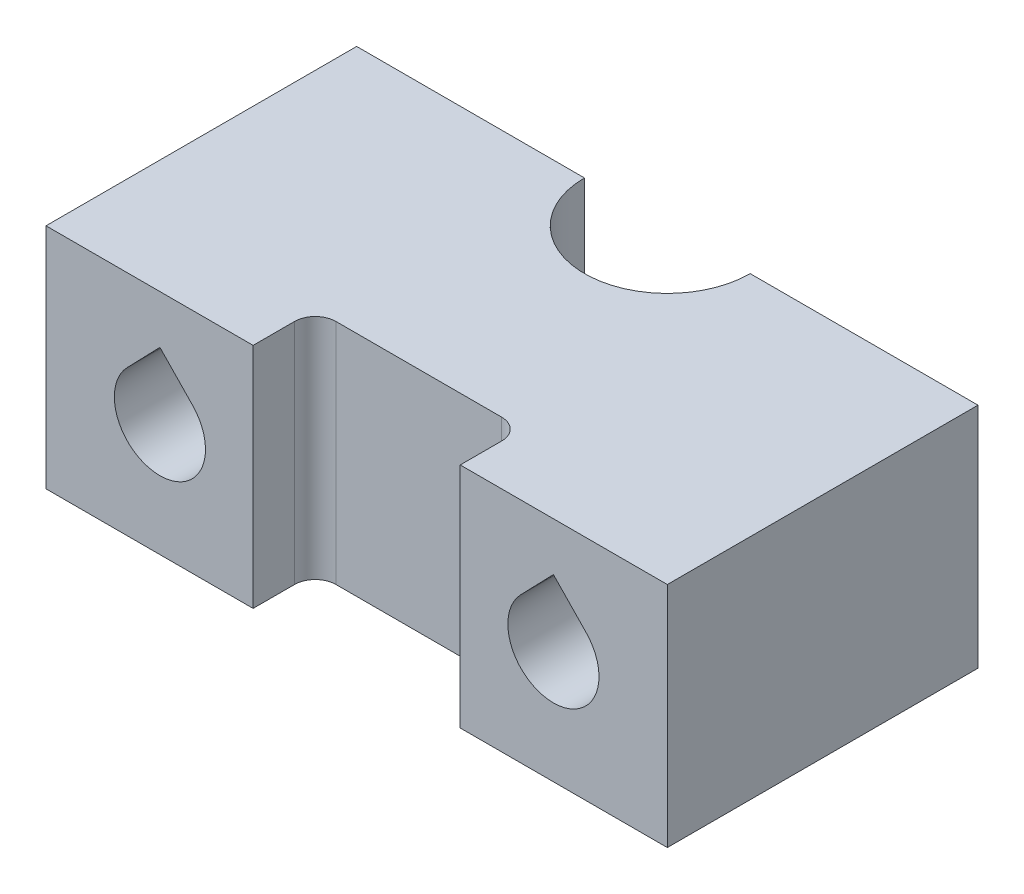
from build123d import *

# Parameters (mm, degrees)
SKETCH1_W           = 30
SKETCH1_H           = 15
BOSS_EXTRUDE1_DEPTH = 11
SKETCH2_W           = 10
SKETCH2_H           = 3
CUT_EXTRUDE1_DEPTH  = 65.585215026
CUT_EXTRUDE2_DEPTH  = 64.304818142
CUT_EXTRUDE3_DEPTH  = 64.304818142
HOLE1_D             = 8
FILLET1_R           = 1
FILLET2_R           = 1


with BuildPart() as part:
    # Sketch1 → Boss-Extrude1 (new body)
    with BuildSketch(Plane.XZ.offset(36.5)):
        with Locations((-34.5, 32.5)):
            Rectangle(SKETCH1_W, SKETCH1_H)
    extrude(amount=-BOSS_EXTRUDE1_DEPTH)

    # Sketch2 → Cut-Extrude1 (cut, through all)
    with BuildSketch(Plane(origin=(0, -25.5, 0), x_dir=(-1, 0, 0), z_dir=(0, 1, 0))):
        with Locations((34.5, 38.5)):
            Rectangle(SKETCH2_W, SKETCH2_H)
    extrude(amount=-CUT_EXTRUDE1_DEPTH, mode=Mode.SUBTRACT)

    # Sketch3 → Cut-Extrude2 (cut, through all)
    with BuildSketch(Plane(origin=(0, 0, 25), x_dir=(-1, 0, 0), z_dir=(0, 0, -1))):
        with BuildLine():
            Line((45.582547561, -29.471751585), (44, -27.832975613))
            Line((44, -27.832975613), (42.417452439, -29.471751585))
            ThreePointArc((42.417452439, -29.471751585), (44, -33.2), (45.582547561, -29.471751585))
        make_face()
    extrude(amount=-CUT_EXTRUDE2_DEPTH, mode=Mode.SUBTRACT)

    # Sketch4 → Cut-Extrude3 (cut, through all)
    with BuildSketch(Plane.XY.offset(40)):
        with BuildLine():
            Line((-25, -27.832975613), (-26.582547561, -29.471751585))
            ThreePointArc((-26.582547561, -29.471751585), (-25, -33.2), (-23.417452439, -29.471751585))
            Line((-23.417452439, -29.471751585), (-25, -27.832975613))
        make_face()
    extrude(amount=-CUT_EXTRUDE3_DEPTH, mode=Mode.SUBTRACT)

    # Hole1 (through all)
    with Locations(Plane.XZ.offset(36.5)):
        with Locations((-34.5, 25)):
            Hole(HOLE1_D / 2)

    # Fillet1
    fillet1_edges = [part.edges().sort_by_distance(p)[0] for p in [
        (-39.5, -31, 37),
    ]]
    fillet(fillet1_edges, radius=FILLET1_R)

    # Fillet2
    fillet2_edges = [part.edges().sort_by_distance(p)[0] for p in [
        (-29.5, -31, 37),
    ]]
    fillet(fillet2_edges, radius=FILLET2_R)


solid = part.part
